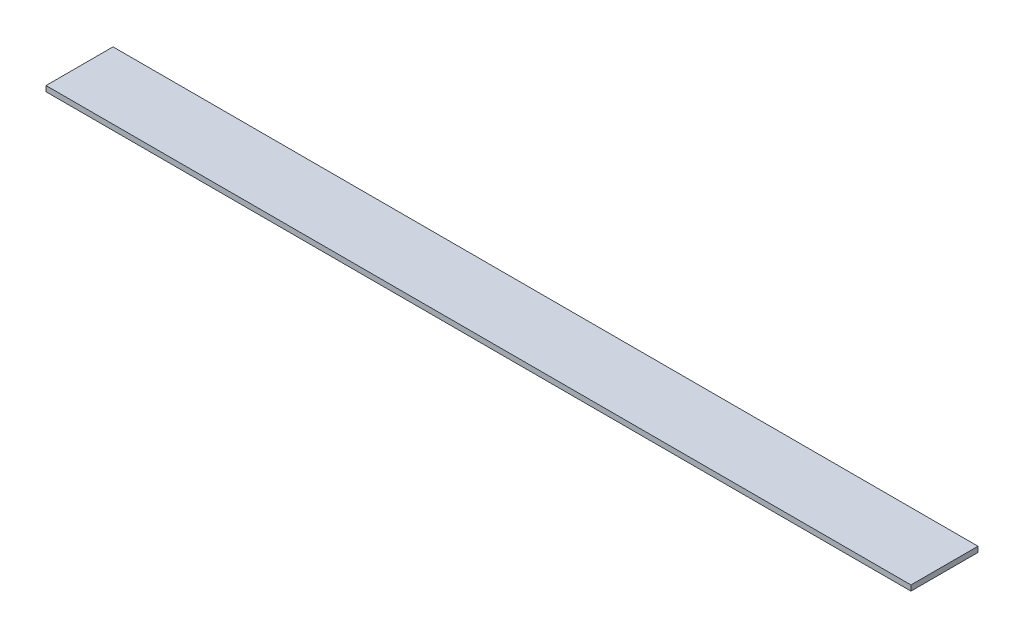
from build123d import *

# Parameters (mm, degrees)
SKETCH1_W           = 508
SKETCH1_H           = 39.37
BOSS_EXTRUDE1_DEPTH = 3.175


with BuildPart() as part:
    # Sketch1 → Boss-Extrude1 (new body)
    with BuildSketch(Plane(origin=(0, 0, 0), x_dir=(1, 0, 0), z_dir=(0, 1, 0))):
        Rectangle(SKETCH1_W, SKETCH1_H)
    extrude(amount=BOSS_EXTRUDE1_DEPTH)


solid = part.part
